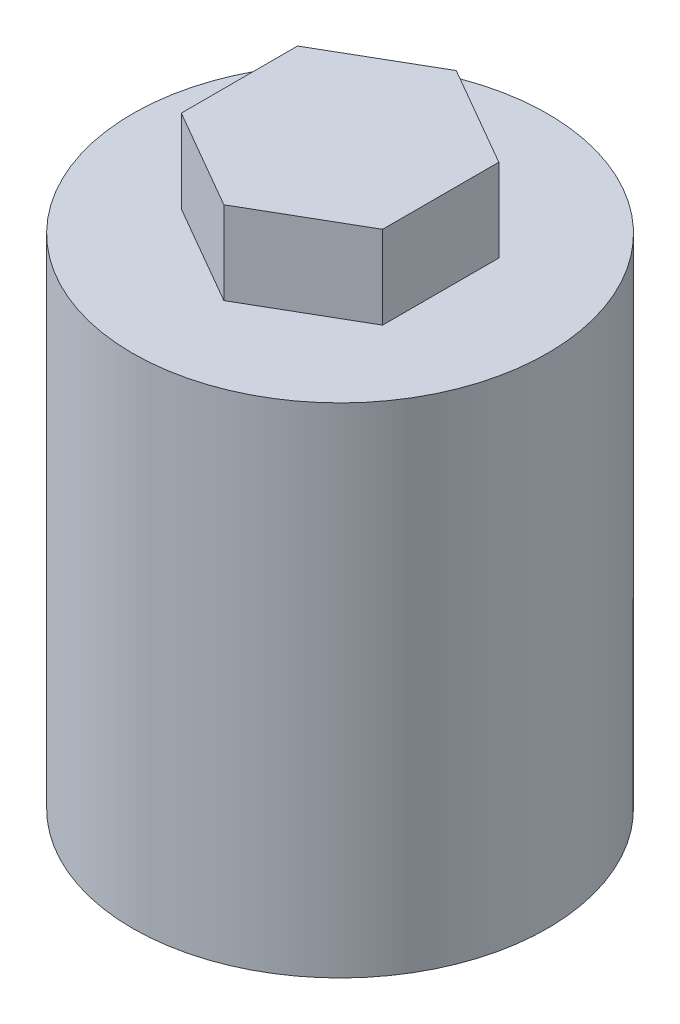
from build123d import *

# Parameters (mm, degrees)
SKETCH_1_R      = 25
EXTRUDE_1_DEPTH = 60
EXTRUDE_2_DEPTH = 10


with BuildPart() as part:
    # 草图1 → 凸台-拉伸1 (new body)
    with BuildSketch(Plane(origin=(0, 0, 0), x_dir=(1, 0, 0), z_dir=(0, 1, 0))):
        with Locations(Location((0, 0, 0), (0, 0, 270))):
            Circle(SKETCH_1_R)
    extrude(amount=EXTRUDE_1_DEPTH)

    # 草图2 → 凸台-拉伸2 (add)
    with BuildSketch(Plane(origin=(0, 60, 0), x_dir=(1, 0, 0), z_dir=(0, 1, 0))):
        Polygon((0, 14), (-12.124355653, 7), (-12.124355653, -7), (0, -14), (12.124355653, -7), (12.124355653, 7), align=None)
    extrude(amount=EXTRUDE_2_DEPTH)


solid = part.part
